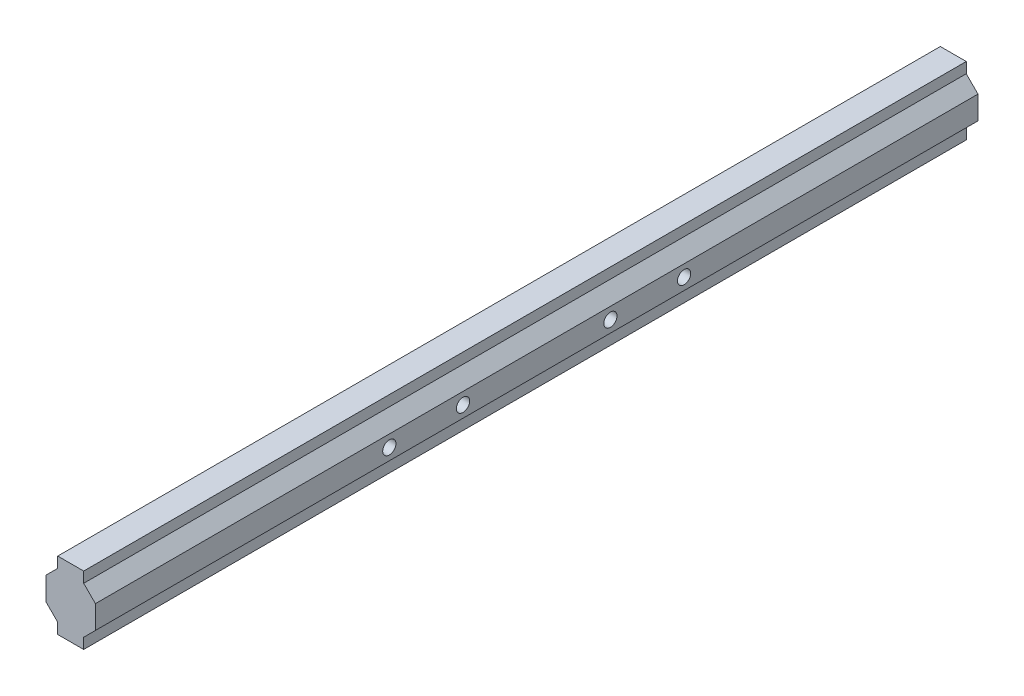
from build123d import *

# Parameters (mm, degrees)
BOSS_EXTRUDE1_DEPTH = 200
SKETCH2_R           = 1.5
CUT_EXTRUDE1_DEPTH  = 20


with BuildPart() as part:
    # Sketch1 → Boss-Extrude1 (new body)
    with BuildSketch(Plane.XY.offset(116.106580091)):
        Polygon((-39.550290087, 5.294235639), (-36.889629915, 7.954895811), (-36.889629915, 10.362002592), (-31.010950259, 10.362002592), (-31.010950259, 7.954895811), (-28.350290087, 5.294235639), (-28.350290087, 0.029769545), (-31.010950259, -2.630890626), (-31.010950259, -5.037997408), (-36.889629915, -5.037997408), (-36.889629915, -2.630890626), (-39.550290087, 0.029769545), align=None)
    extrude(amount=BOSS_EXTRUDE1_DEPTH)

    # Sketch2 → Cut-Extrude1 (cut)
    with BuildSketch(Plane(origin=(-28.350290087, 0, 0), x_dir=(0, 0, -1), z_dir=(1, 0, 0))):
        with Locations((-232.806580091, 2.662002592)):
            Circle(SKETCH2_R)
        with Locations((-249.506580091, 2.662002592)):
            Circle(SKETCH2_R)
        with Locations((-199.406580091, 2.662002592)):
            Circle(SKETCH2_R)
        with Locations((-182.706580091, 2.662002592)):
            Circle(SKETCH2_R)
    extrude(amount=-CUT_EXTRUDE1_DEPTH, mode=Mode.SUBTRACT)


solid = part.part
